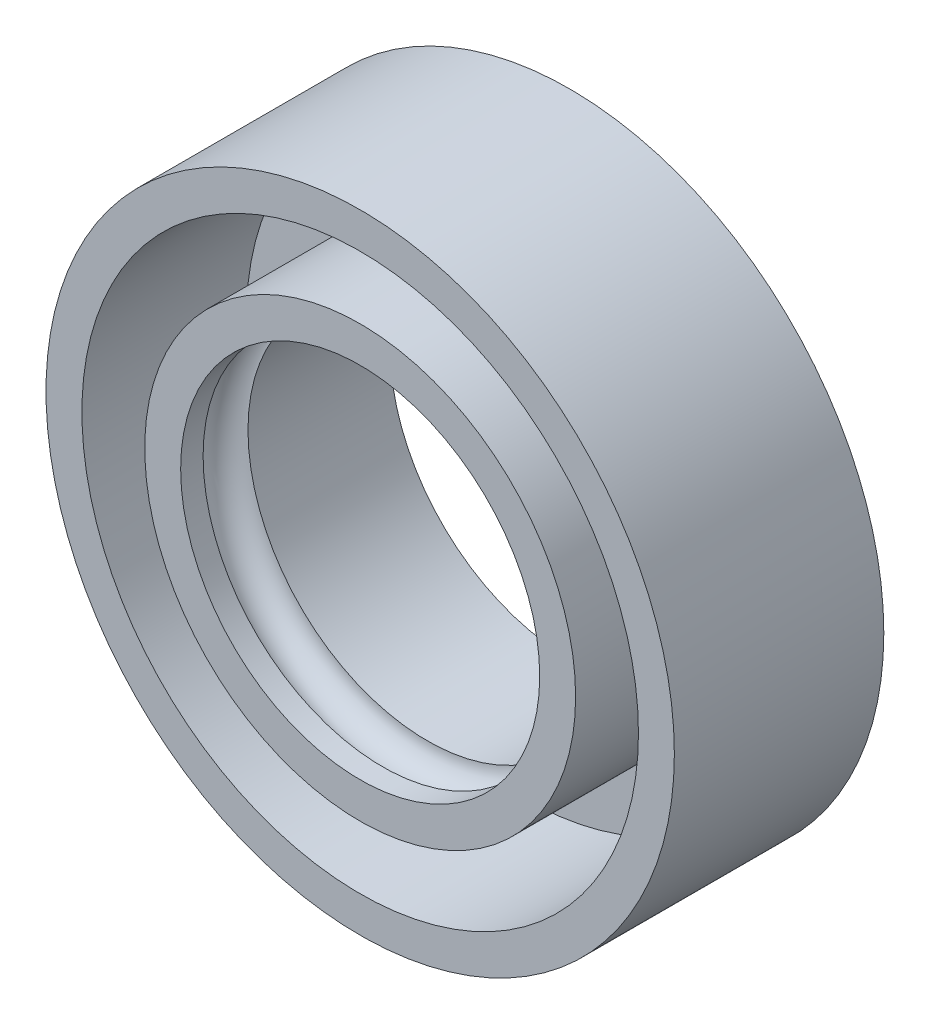
from build123d import *

# Parameters (mm, degrees)
SKETCH_1_R          = 10.5
EXTRUDE_1_DEPTH     = 7
SKETCH_2_R          = 6
CUT_EXTRUDE_1_DEPTH = 17.416455159
SKETCH_3_R          = 9.3
SKETCH_3_R_2        = 7.2
CUT_EXTRUDE_2_DEPTH = 5.5
SWEEP_1_PROFILE_R   = 0.75


with BuildPart() as part:
    # 草图1 → 凸台-拉伸1 (new body)
    with BuildSketch(Plane.XY):
        Circle(SKETCH_1_R)
    extrude(amount=EXTRUDE_1_DEPTH)

    # 草图2 → 切除-拉伸1 (cut, through all)
    with BuildSketch(Plane.XY.offset(7)):
        Circle(SKETCH_2_R)
    extrude(amount=-CUT_EXTRUDE_1_DEPTH, mode=Mode.SUBTRACT)

    # 草图3 → 切除-拉伸2 (cut)
    with BuildSketch(Plane.XY.offset(7)):
        Circle(SKETCH_3_R)
        Circle(SKETCH_3_R_2, mode=Mode.SUBTRACT)
    extrude(amount=-CUT_EXTRUDE_2_DEPTH, mode=Mode.SUBTRACT)

    # 切除-扫描1: sweep along a path in 草图5
    with BuildLine(Plane.XY.offset(5.5)) as sweep_1_path:
        CenterArc((0, 0), 6, 0, 360)
    # 切除-扫描1 profile (on start of the path) → 切除-扫描1 (sweep, cut)
    with BuildSketch(Plane(origin=(6, 0, 5.5), x_dir=(0, 0, 1), z_dir=(0, 1, 0))):
        Circle(SWEEP_1_PROFILE_R)
    sweep(path=sweep_1_path.line, mode=Mode.SUBTRACT)


solid = part.part
